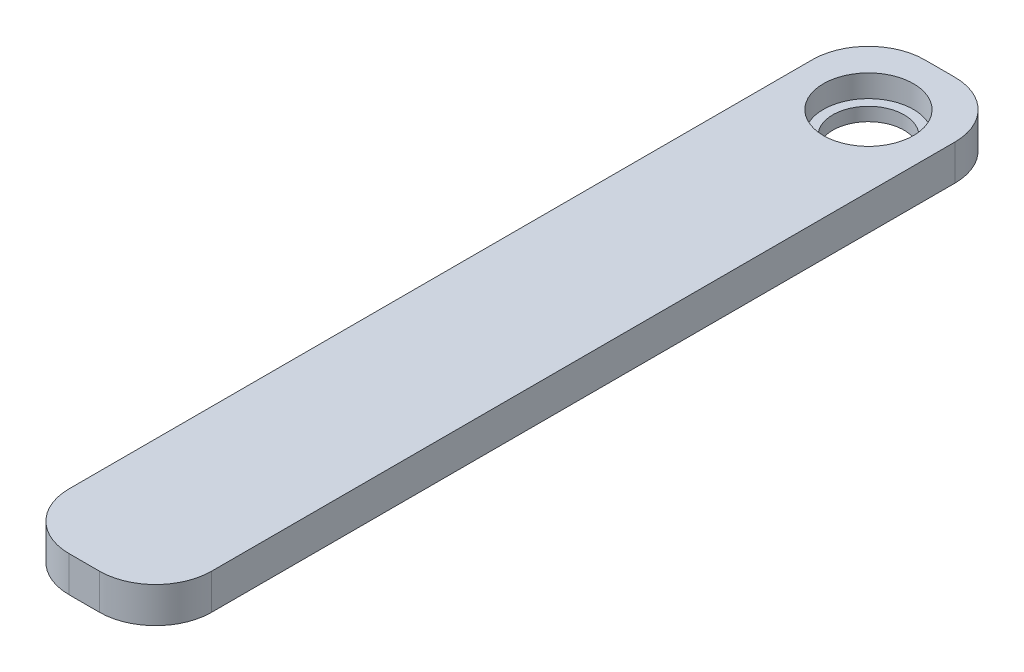
from build123d import *

# Parameters (mm, degrees)
SKETCH1_W           = 25.4
SKETCH1_H           = 152.4
BOSS_EXTRUDE1_DEPTH = 6.35
SKETCH5_R           = 8.016875
CUT_EXTRUDE1_DEPTH  = 3.96875
SKETCH6_R           = 6.35
CUT_EXTRUDE2_DEPTH  = 155.553133183
SKETCH7_R           = 3.429
CUT_EXTRUDE3_DEPTH  = 7.62
SKETCH9_W           = 11.198432991
SKETCH9_H           = 1.819618823
BOSS_EXTRUDE2_DEPTH = 6.35
BOSS_EXTRUDE4_START = -6.35
SKETCH11_W          = 13.636513595
SKETCH11_H          = 8.31497605
BOSS_EXTRUDE4_DEPTH = 1.27
FILLET1_R           = 10


with BuildPart() as part:
    # Sketch1 → Boss-Extrude1 (new body)
    with BuildSketch(Plane(origin=(0, 0, 0), x_dir=(1, 0, 0), z_dir=(0, 1, 0))):
        with Locations((12.7, 76.2)):
            Rectangle(SKETCH1_W, SKETCH1_H)
    extrude(amount=BOSS_EXTRUDE1_DEPTH)

    # Sketch5 → Cut-Extrude1 (cut)
    with BuildSketch(Plane(origin=(0, 6.35, 0), x_dir=(1, 0, 0), z_dir=(0, 1, 0))):
        with Locations(Location((12.7, 139.7, 0), (0, 0, 270))):
            Circle(SKETCH5_R)
    extrude(amount=-CUT_EXTRUDE1_DEPTH, mode=Mode.SUBTRACT)

    # Sketch6 → Cut-Extrude2 (cut, through all)
    with BuildSketch(Plane(origin=(0, 2.38125, 0), x_dir=(1, 0, 0), z_dir=(0, 1, 0))):
        with Locations(Location((12.7, 139.7, 0), (0, 0, 270))):
            Circle(SKETCH6_R)
    extrude(amount=-CUT_EXTRUDE2_DEPTH, mode=Mode.SUBTRACT)

    # Sketch7 → Cut-Extrude3 (cut)
    with BuildSketch(Plane(origin=(0, 6.35, 0), x_dir=(1, 0, 0), z_dir=(0, 1, 0))):
        with Locations(Location((12.7, 6.35, 0), (0, 0, 270))):
            Circle(SKETCH7_R)
    extrude(amount=-CUT_EXTRUDE3_DEPTH, mode=Mode.SUBTRACT)

    # Sketch9 → Boss-Extrude2 (add, through all)
    with BuildSketch(Plane(origin=(0, 6.35, 0), x_dir=(1, 0, 0), z_dir=(0, 1, 0))):
        with Locations((12.325928429, 9.647409411)):
            Rectangle(SKETCH9_W, SKETCH9_H)
    extrude(amount=-BOSS_EXTRUDE2_DEPTH)

    # Sketch11 → Boss-Extrude4 (add)
    with BuildSketch(Plane.XZ.offset(BOSS_EXTRUDE4_START)):
        with Locations((12.44089651, -6.12924614)):
            Rectangle(SKETCH11_W, SKETCH11_H)
    extrude(amount=BOSS_EXTRUDE4_DEPTH)

    # Fillet1
    fillet1_edges = [part.edges().sort_by_distance(p)[0] for p in [
        (0, 3.175, -152.4),
        (25.4, 3.175, -152.4),
        (25.4, 3.175, 0),
        (0, 3.175, 0),
    ]]
    fillet(fillet1_edges, radius=FILLET1_R)


solid = part.part
